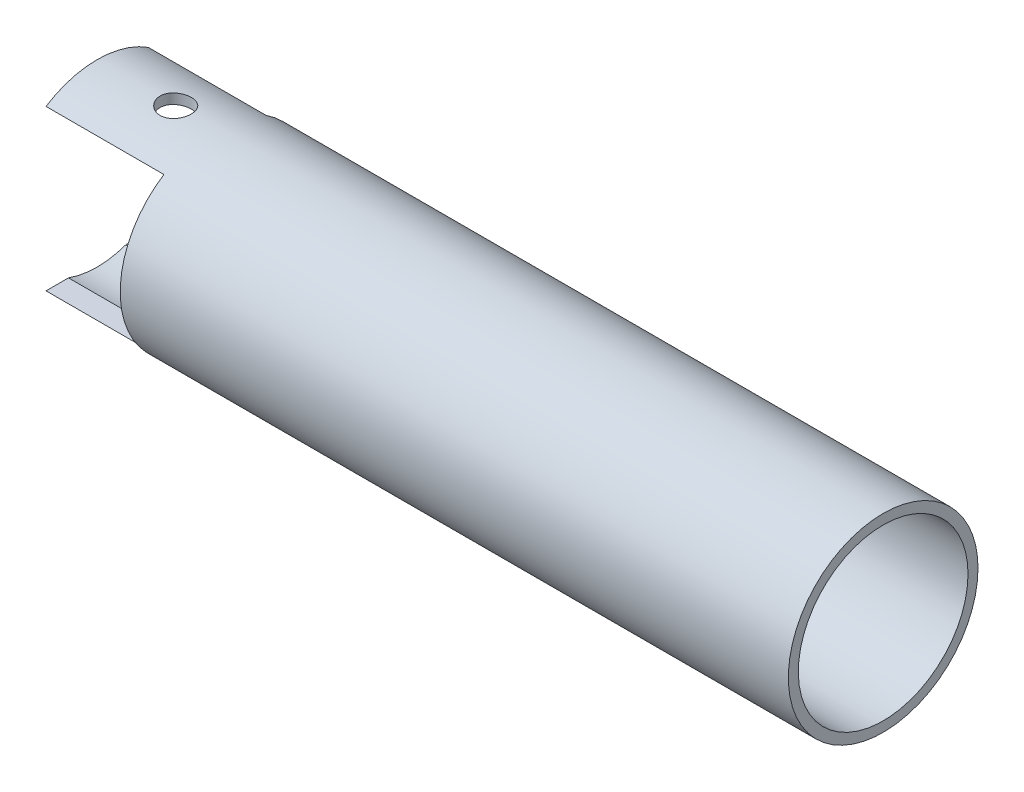
from build123d import *

# Parameters (mm, degrees)
SKETCH1_R               = 1.2065
SKETCH1_R_2             = 1.0795
BOSS_EXTRUDE1_DEPTH     = 10
SKETCH2_W               = 4.648816228
SKETCH2_H               = 2.032
CUT_EXTRUDE1_DEPTH      = 1.5
CUT_EXTRUDE2_DEPTH      = 5
CUT_EXTRUDE2_DEPTH_BACK = 5
SKETCH4_R               = 0.1984375


with BuildPart() as part:
    # Sketch1 → Boss-Extrude1 (new body)
    with BuildSketch(Plane(origin=(0, 0, 0), x_dir=(0, 0, -1), z_dir=(1, 0, 0))):
        Circle(SKETCH1_R)
        Circle(SKETCH1_R_2, mode=Mode.SUBTRACT)
    extrude(amount=BOSS_EXTRUDE1_DEPTH)

    # Sketch2 → Cut-Extrude1 (cut)
    with BuildSketch(Plane.ZY):
        with Locations((0.126795446, 0)):
            Rectangle(SKETCH2_W, SKETCH2_H)
    extrude(amount=-CUT_EXTRUDE1_DEPTH, mode=Mode.SUBTRACT)

    # Sketch4 → Cut-Extrude2 (cut, two sides: drawn at the far end of the back side and taken through both)
    with BuildSketch(Plane(origin=(0, 0, 0), x_dir=(1, 0, 0), z_dir=(0, 1, 0)).offset(-CUT_EXTRUDE2_DEPTH_BACK)):
        with Locations(Location((1, 0, 0), (0, 0, 90))):
            Circle(SKETCH4_R)
    extrude(amount=CUT_EXTRUDE2_DEPTH + CUT_EXTRUDE2_DEPTH_BACK, mode=Mode.SUBTRACT)


solid = part.part
